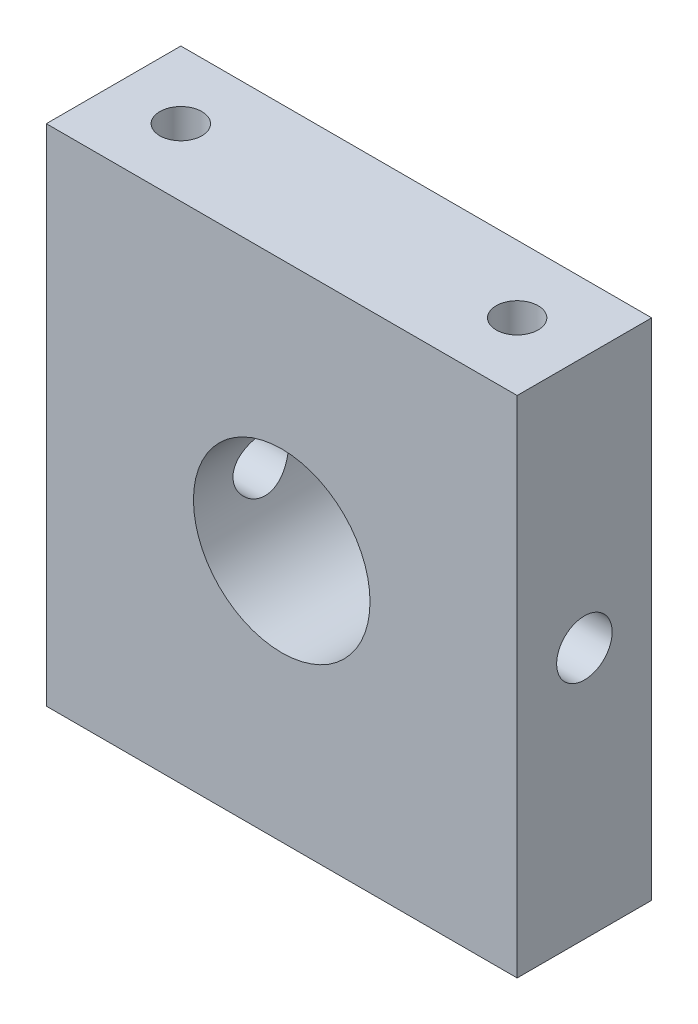
from build123d import *

# Parameters (mm, degrees)
SKETCH_1_W             = 28
SKETCH_1_H             = 30
SKETCH_1_R             = 5.25
EXTRUDE_1_DEPTH        = 8
HOLE_WIZARD_M3_1_D     = 2.5
HOLE_WIZARD_M3_1_DEPTH = 11.5
HOLE_WIZARD_M3_1_TIP   = 0.751075774
HOLE_WIZARD_M3_2_D     = 2.5
HOLE_WIZARD_M3_2_DEPTH = 11.5
HOLE_WIZARD_M3_2_TIP   = 0.751075774
HOLE_WIZARD_M4_1_D     = 3.3


with BuildPart() as part:
    # 草图1 → 凸台-拉伸1 (new body)
    with BuildSketch(Plane.XY):
        Rectangle(SKETCH_1_W, SKETCH_1_H)
        Circle(SKETCH_1_R, mode=Mode.SUBTRACT)
    extrude(amount=EXTRUDE_1_DEPTH)

    # M3 螺纹孔1
    with Locations(Plane(origin=(0, 15, 0), x_dir=(1, 0, 0), z_dir=(0, 1, 0))):
        with Locations((-10, -4), (10, -4)):
            Hole(HOLE_WIZARD_M3_1_D / 2, depth=HOLE_WIZARD_M3_1_DEPTH)
            with Locations((0, 0, -(HOLE_WIZARD_M3_1_DEPTH + HOLE_WIZARD_M3_1_TIP / 2))):  # 118° drill point
                Cone(0, HOLE_WIZARD_M3_1_D / 2, HOLE_WIZARD_M3_1_TIP, mode=Mode.SUBTRACT)

    # M3 螺纹孔2
    with Locations(Plane(origin=(0, -15, 0), x_dir=(-1, 0, 0), z_dir=(0, -1, 0))):
        with Locations((10, -4), (-10, -4)):
            Hole(HOLE_WIZARD_M3_2_D / 2, depth=HOLE_WIZARD_M3_2_DEPTH)
            with Locations((0, 0, -(HOLE_WIZARD_M3_2_DEPTH + HOLE_WIZARD_M3_2_TIP / 2))):  # 118° drill point
                Cone(0, HOLE_WIZARD_M3_2_D / 2, HOLE_WIZARD_M3_2_TIP, mode=Mode.SUBTRACT)

    # M4 螺纹孔1 (through all)
    with Locations(Plane(origin=(14, 0, 0), x_dir=(0, 0, -1), z_dir=(1, 0, 0))):
        with Locations((-4, 0)):
            Hole(HOLE_WIZARD_M4_1_D / 2)


solid = part.part
